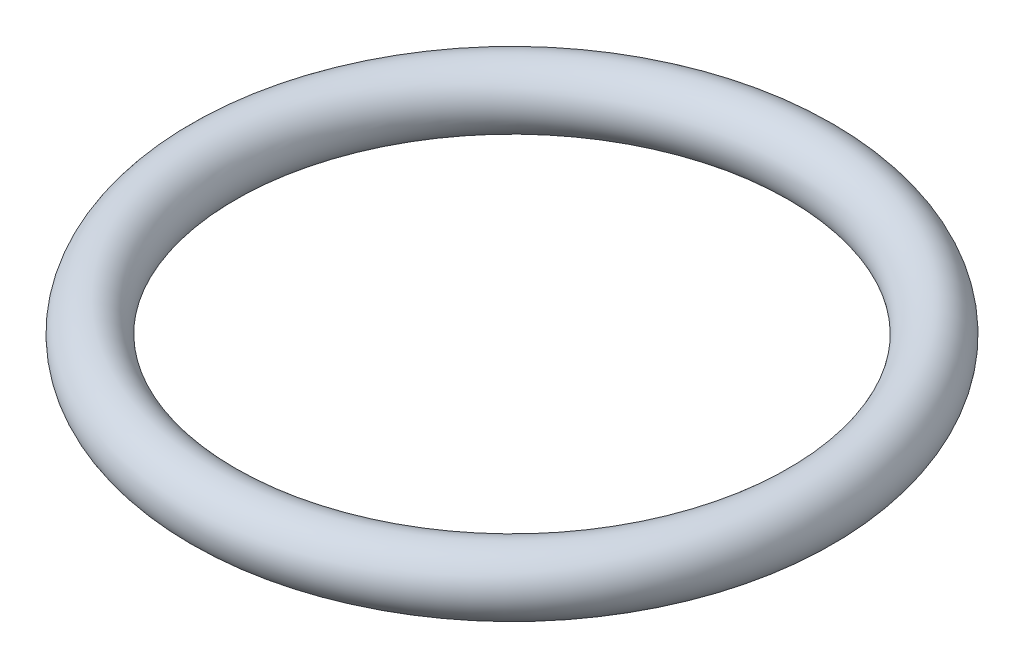
from build123d import *

# Parameters (mm, degrees)
SKETCH1_R = 0.9906


with BuildPart() as part:
    # Sketch1 → Revolve1 (revolve)
    with BuildSketch(Plane.XY, mode=Mode.PRIVATE) as revolve1_sk:
        with Locations((9.525, 0)):
            Circle(SKETCH1_R)
    revolve(revolve1_sk.sketch.rotate(Axis((0, 0, 0), (0, 1, 0)), 90), axis=Axis((0, 0, 0), (0, 1, 0)))


solid = part.part
